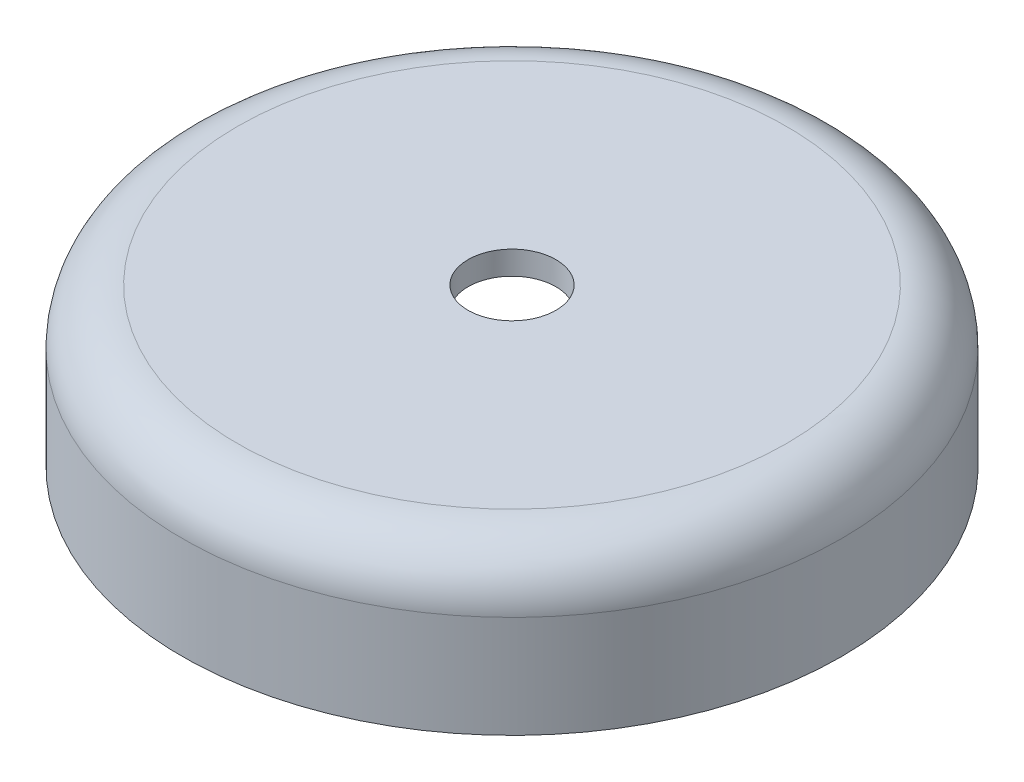
from build123d import *

# Parameters (mm, degrees)
ENL_V_MAT_EXTRU_1_REACH = 46.772
ESQUISSE3_R             = 4


with BuildPart() as part:
    # Esquisse2 → Révolution1 (revolve)
    with BuildSketch(Plane.XY):
        with BuildLine():
            Line((0, 0), (-25, 0))
            ThreePointArc((-25, 0), (-28.535533906, -1.464466094), (-30, -5))
            Line((-30, -5), (-30, -14.3))
            Line((-30, -14.3), (-27.86, -14.3))
            Line((-27.86, -14.3), (-27.86, -6.14))
            ThreePointArc((-27.86, -6.14), (-26.688427125, -3.311572875), (-23.86, -2.14))
            Line((-23.86, -2.14), (0, -2.14))
            Line((0, -2.14), (0, 0))
        make_face()
    revolve(axis=Axis((0, 0, 0), (0, -1, 0)))

    # Esquisse3 → Enlèv. mat.-Extru.1 (cut, up to next)
    with BuildSketch(Plane(origin=(0, 0, 0), x_dir=(1, 0, 0), z_dir=(0, 1, 0)), mode=Mode.PRIVATE) as enl_v_mat_extru_1_sk1:
        with Locations(Location((0, 0, 0), (0, 0, 180))):
            Circle(ESQUISSE3_R)
    enl_v_mat_extru_1_tool1 = extrude(enl_v_mat_extru_1_sk1.sketch, amount=-ENL_V_MAT_EXTRU_1_REACH, mode=Mode.PRIVATE) & part.part
    add(enl_v_mat_extru_1_tool1.solids().sort_by_distance((0, 0, 0))[0], mode=Mode.SUBTRACT)


solid = part.part
